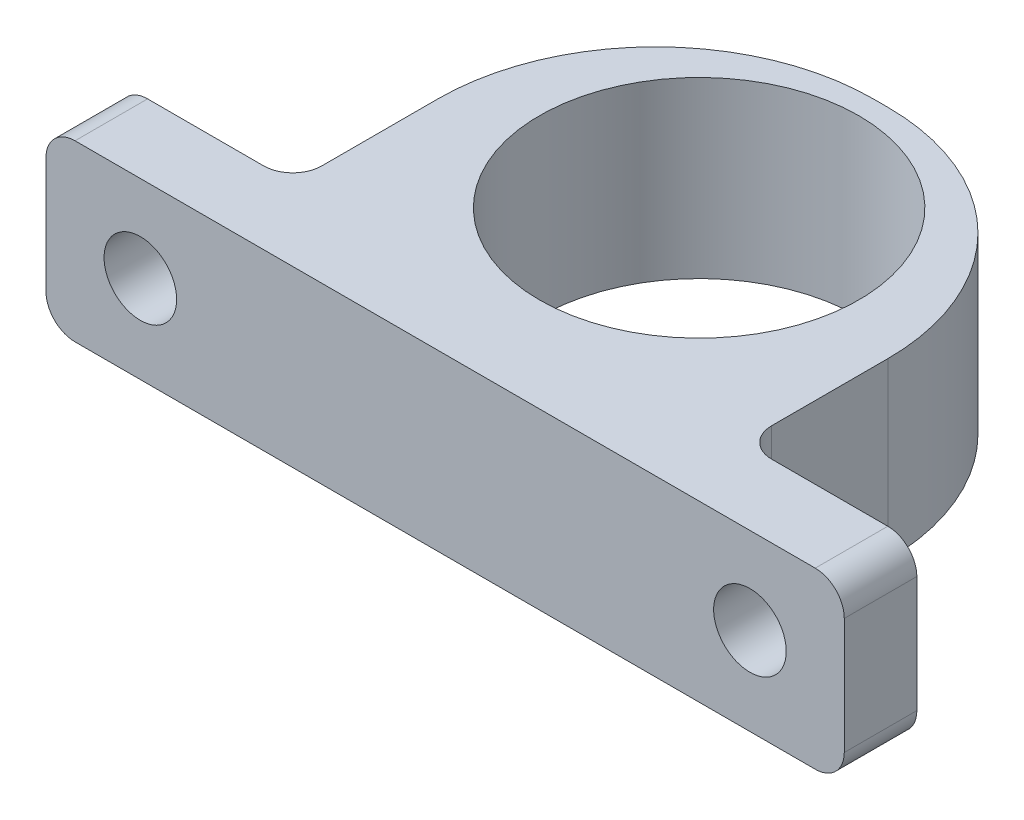
from build123d import *

# Parameters (mm, degrees)
BOSS_EXTRUDE1_DEPTH = 12
SKETCH3_R           = 11
CUT_EXTRUDE1_DEPTH  = 12
FILLET1_R           = 15
FILLET2_R           = 15
FILLET3_R           = 2
FILLET4_R           = 2
SKETCH4_R           = 2.5
CUT_EXTRUDE2_DEPTH  = 12
FILLET5_R           = 2
FILLET6_R           = 2
FILLET7_R           = 2
FILLET8_R           = 2


with BuildPart() as part:
    # Sketch2 → Boss-Extrude1 (new body)
    with BuildSketch(Plane(origin=(0, 0, 0), x_dir=(1, 0, 0), z_dir=(0, 1, 0))):
        Polygon((0, 0), (55, 0), (55, 5), (43, 5), (43, 30), (12, 30), (12, 5), (0, 5), align=None)
    extrude(amount=BOSS_EXTRUDE1_DEPTH)

    # Sketch3 → Cut-Extrude1 (cut)
    with BuildSketch(Plane.XZ):
        with Locations(Location((27.5, -17.5, 0), (0, 0, 270))):
            Circle(SKETCH3_R)
    extrude(amount=-CUT_EXTRUDE1_DEPTH, mode=Mode.SUBTRACT)

    # Fillet1
    fillet1_edges = [part.edges().sort_by_distance(p)[0] for p in [
        (43, 6, -30),
    ]]
    fillet(fillet1_edges, radius=FILLET1_R)

    # Fillet2
    fillet2_edges = [part.edges().sort_by_distance(p)[0] for p in [
        (12, 6, -30),
    ]]
    fillet(fillet2_edges, radius=FILLET2_R)

    # Fillet3
    fillet3_edges = [part.edges().sort_by_distance(p)[0] for p in [
        (12, 6, -5),
    ]]
    fillet(fillet3_edges, radius=FILLET3_R)

    # Fillet4
    fillet4_edges = [part.edges().sort_by_distance(p)[0] for p in [
        (43, 6, -5),
    ]]
    fillet(fillet4_edges, radius=FILLET4_R)

    # Sketch4 → Cut-Extrude2 (cut)
    with BuildSketch(Plane.XY):
        with Locations((48.5, 6.034122725)):
            Circle(SKETCH4_R)
        with Locations((6.5, 6.034122725)):
            Circle(SKETCH4_R)
    extrude(amount=-CUT_EXTRUDE2_DEPTH, mode=Mode.SUBTRACT)

    # Fillet5
    fillet5_edges = [part.edges().sort_by_distance(p)[0] for p in [
        (55, 0, -2.5),
    ]]
    fillet(fillet5_edges, radius=FILLET5_R)

    # Fillet6
    fillet6_edges = [part.edges().sort_by_distance(p)[0] for p in [
        (55, 12, -2.5),
    ]]
    fillet(fillet6_edges, radius=FILLET6_R)

    # Fillet7
    fillet7_edges = [part.edges().sort_by_distance(p)[0] for p in [
        (0, 12, -2.5),
    ]]
    fillet(fillet7_edges, radius=FILLET7_R)

    # Fillet8
    fillet8_edges = [part.edges().sort_by_distance(p)[0] for p in [
        (0, 0, -2.5),
    ]]
    fillet(fillet8_edges, radius=FILLET8_R)


solid = part.part
